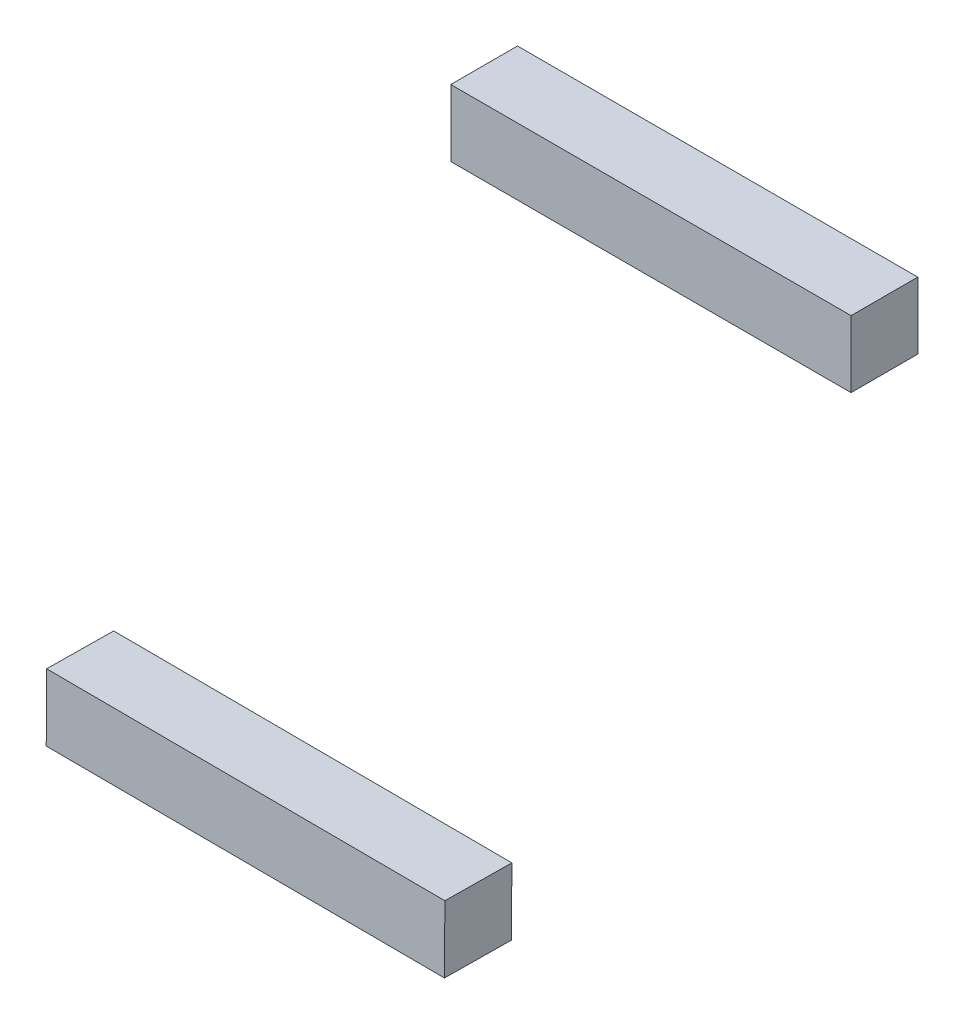
from build123d import *

# Parameters (mm, degrees)
SKETCH1_W           = 30.48
SKETCH1_H           = 5.08
BOSS_EXTRUDE1_DEPTH = 5.08
SKETCH2_W           = 29.464
SKETCH2_H           = 4.064
CUT_EXTRUDE1_DEPTH  = 3.81
SKETCH4_W           = 30.457318312
SKETCH4_H           = 5.08
BOSS_EXTRUDE2_DEPTH = 5.08
SKETCH5_W           = 29.441318312
SKETCH5_H           = 4.064
CUT_EXTRUDE2_DEPTH  = 4.572


with BuildPart() as part:
    # Sketch1 → Boss-Extrude1 (new body)
    with BuildSketch(Plane(origin=(0, 0, 0), x_dir=(1, 0, 0), z_dir=(0, 1, 0))):
        with Locations((15.24, 2.54)):
            Rectangle(SKETCH1_W, SKETCH1_H)
    extrude(amount=BOSS_EXTRUDE1_DEPTH)

    # Sketch2 → Cut-Extrude1 (cut)
    with BuildSketch(Plane.XZ):
        with Locations((15.24, -2.54)):
            Rectangle(SKETCH2_W, SKETCH2_H)
    extrude(amount=-CUT_EXTRUDE1_DEPTH, mode=Mode.SUBTRACT)


with BuildPart() as body_2:
    # Sketch4 → Boss-Extrude2 (new body)
    with BuildSketch(Plane(origin=(-0.000214859, -18.392779658, 0.117809153), x_dir=(0.9999902906340888, 1.654365665117265e-05, 0.004406627265614342), z_dir=(-1.1681479151945916e-05, -0.9999794873667439, 0.0064050534179832894))):
        with Locations((15.228659156, 27.980530597)):
            Rectangle(SKETCH4_W, SKETCH4_H)
    extrude(amount=BOSS_EXTRUDE2_DEPTH)

    # Sketch5 → Cut-Extrude2 (cut)
    with BuildSketch(Plane(origin=(-0.000274201, -23.472675454, 0.150346824), x_dir=(0.999990290634089, 1.6543656651029003e-05, 0.004406627265591424), z_dir=(1.1681479151941708e-05, 0.9999794873667439, -0.006405053417983048))):
        with Locations((15.228659156, -27.980530597)):
            Rectangle(SKETCH5_W, SKETCH5_H)
    extrude(amount=CUT_EXTRUDE2_DEPTH, mode=Mode.SUBTRACT)


solid = Compound([part.part, body_2.part])
